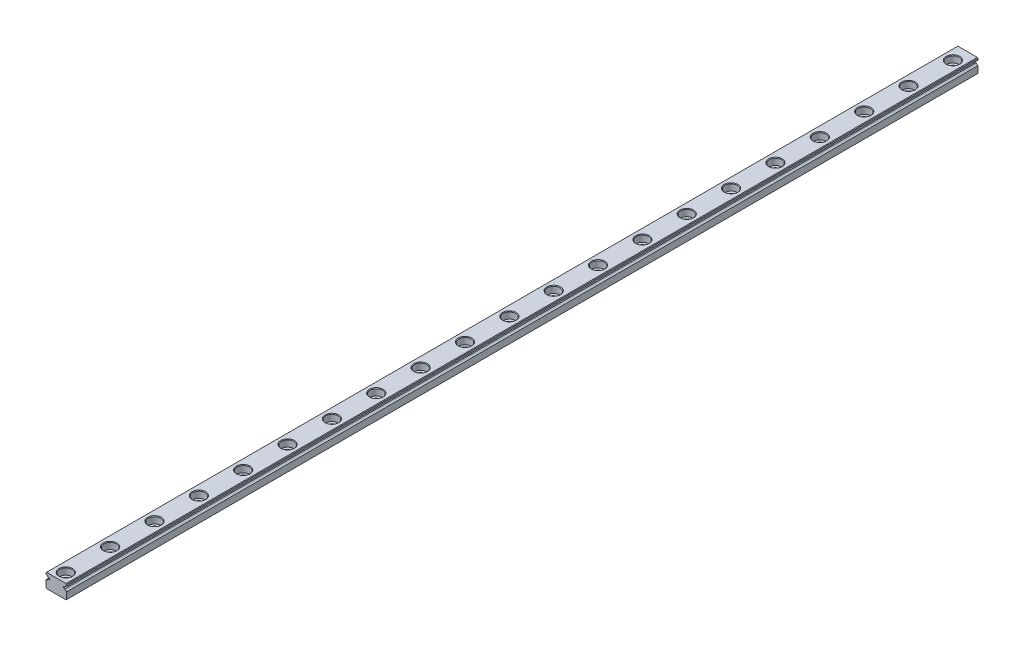
from build123d import *

# Parameters (mm, degrees)
EXTRUDE1_DEPTH             = 308.2
EXTRUDE2_REACH             = 310.257
SKETCH2_R                  = 1.2
SKETCH_R                   = 2.1
SKETCH_R_2                 = 1.2
EXTRUDE4_DEPTH             = 2.3
CHAMFER1_SIZE              = 0.2
LPATTERN1_COUNT            = 21
LPATTERN1_PITCH            = 15
CHAMFER1_OF_LPATTERN1_SIZE = 0.2


with BuildPart() as part:
    # Sketch1 → Extrude1 (new body)
    with BuildSketch(Plane.XY):
        with BuildLine():
            Line((-3.3, -2.4), (3.3, -2.4))
            Line((3.3, -2.4), (3.5, -2.2))
            Line((3.5, -2.2), (3.5, 0.106274607))
            ThreePointArc((3.5, 0.106274607), (3.091294745, 0.282570681), (2.840065792, 0.65))
            Line((2.840065792, 0.65), (2.340065792, 0.65))
            Line((2.340065792, 0.65), (2.340065792, 1.15))
            Line((2.340065792, 1.15), (2.840065792, 1.15))
            ThreePointArc((2.840065792, 1.15), (3.091294745, 1.517429319), (3.5, 1.693725393))
            Line((3.5, 1.693725393), (3.5, 2.2))
            Line((3.5, 2.2), (3.3, 2.4))
            Line((3.3, 2.4), (-3.3, 2.4))
            Line((-3.3, 2.4), (-3.5, 2.2))
            Line((-3.5, 2.2), (-3.5, 1.693725393))
            ThreePointArc((-3.5, 1.693725393), (-3.091294745, 1.517429319), (-2.840065792, 1.15))
            Line((-2.840065792, 1.15), (-2.340065792, 1.15))
            Line((-2.340065792, 1.15), (-2.340065792, 0.65))
            Line((-2.340065792, 0.65), (-2.840065792, 0.65))
            ThreePointArc((-2.840065792, 0.65), (-3.091294745, 0.282570681), (-3.5, 0.106274607))
            Line((-3.5, 0.106274607), (-3.5, -2.2))
            Line((-3.5, -2.2), (-3.3, -2.4))
        make_face()
    extrude(amount=EXTRUDE1_DEPTH)

    # Sketch2 → Extrude2 (cut, up to next)
    with BuildSketch(Plane(origin=(0, 2.4, 0), x_dir=(1, 0, 0), z_dir=(0, 1, 0)), mode=Mode.PRIVATE) as extrude2_sk1:
        with Locations(Location((0, -5, 0), (0, 0, 270))):
            Circle(SKETCH2_R)
    extrude2_tool1 = extrude(extrude2_sk1.sketch, amount=-EXTRUDE2_REACH, mode=Mode.PRIVATE) & part.part
    extrude2 = extrude2_tool1.solids().sort_by_distance((0, 2.4, 5))[0]
    add(extrude2, mode=Mode.SUBTRACT)

    # Sketch → Extrude4 (cut)
    with BuildSketch(Plane(origin=(0, 2.4, 0), x_dir=(1, 0, 0), z_dir=(0, 1, 0))):
        with Locations(Location((0, -5, 0), (0, 0, 270))):
            Circle(SKETCH_R)
        with Locations(Location((0, -5, 0), (0, 0, 270))):
            Circle(SKETCH_R_2, mode=Mode.SUBTRACT)
    extrude4 = extrude(amount=-EXTRUDE4_DEPTH, mode=Mode.SUBTRACT)

    # Chamfer1
    chamfer1_edges = [part.edges().sort_by_distance(p)[0] for p in [
        (0, -2.4, 3.8),
        (0, 2.4, 2.9),
    ]]
    chamfer(chamfer1_edges, length=CHAMFER1_SIZE)

    # LPattern1: Extrude2, Extrude4 ×21
    with Locations(*[(0, 0, i * LPATTERN1_PITCH) for i in range(1, LPATTERN1_COUNT)]):
        add(extrude2, mode=Mode.SUBTRACT)
        add(extrude4, mode=Mode.SUBTRACT)

    # Chamfer1 of LPattern1
    chamfer1_of_lpattern1_edges = [part.edges().sort_by_distance(p)[0] for p in [
        (0, -2.4, 18.8),
        (0, 2.4, 17.9),
        (0, -2.4, 33.8),
        (0, 2.4, 32.9),
        (0, -2.4, 48.8),
        (0, 2.4, 47.9),
        (0, -2.4, 63.8),
        (0, 2.4, 62.9),
        (0, -2.4, 78.8),
        (0, 2.4, 77.9),
        (0, -2.4, 93.8),
        (0, 2.4, 92.9),
        (0, -2.4, 108.8),
        (0, 2.4, 107.9),
        (0, -2.4, 123.8),
        (0, 2.4, 122.9),
        (0, -2.4, 138.8),
        (0, 2.4, 137.9),
        (0, -2.4, 153.8),
        (0, 2.4, 152.9),
        (0, -2.4, 168.8),
        (0, 2.4, 167.9),
        (0, -2.4, 183.8),
        (0, 2.4, 182.9),
        (0, -2.4, 198.8),
        (0, 2.4, 197.9),
        (0, -2.4, 213.8),
        (0, 2.4, 212.9),
        (0, -2.4, 228.8),
        (0, 2.4, 227.9),
        (0, -2.4, 243.8),
        (0, 2.4, 242.9),
        (0, -2.4, 258.8),
        (0, 2.4, 257.9),
        (0, -2.4, 273.8),
        (0, 2.4, 272.9),
        (0, -2.4, 288.8),
        (0, 2.4, 287.9),
        (0, -2.4, 303.8),
        (0, 2.4, 302.9),
    ]]
    chamfer(chamfer1_of_lpattern1_edges, length=CHAMFER1_OF_LPATTERN1_SIZE)


solid = part.part
